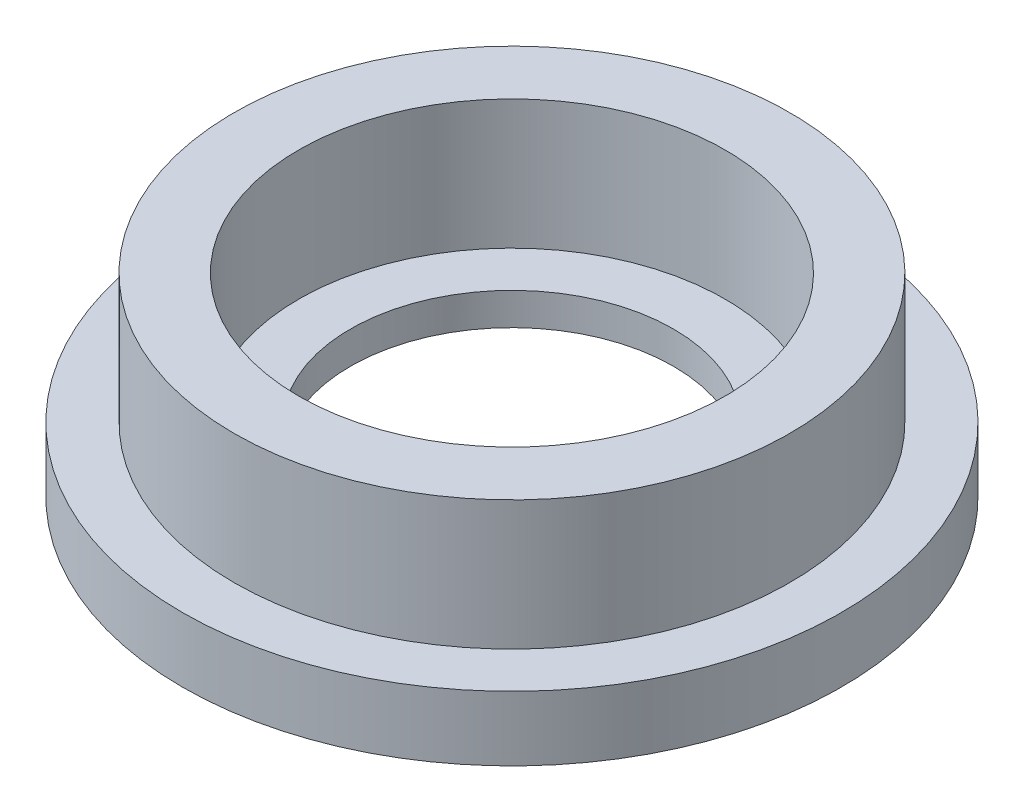
from build123d import *

# Parameters (mm, degrees)
SKETCH1_R           = 5.1
BOSS_EXTRUDE1_DEPTH = 1
SKETCH2_R           = 4.3
SKETCH2_R_2         = 3.3
BOSS_EXTRUDE2_DEPTH = 2
SKETCH3_R           = 2.5
CUT_EXTRUDE1_DEPTH  = 2
SKETCH4_R           = 3.3
CUT_EXTRUDE2_DEPTH  = 0.5


with BuildPart() as part:
    # Sketch1 → Boss-Extrude1 (new body)
    with BuildSketch(Plane(origin=(0, 0, 0), x_dir=(1, 0, 0), z_dir=(0, 1, 0))):
        with Locations(Location((0, 0, 0), (0, 0, 270))):
            Circle(SKETCH1_R)
    extrude(amount=BOSS_EXTRUDE1_DEPTH)

    # Sketch2 → Boss-Extrude2 (add)
    with BuildSketch(Plane(origin=(0, 1, 0), x_dir=(1, 0, 0), z_dir=(0, 1, 0))):
        with Locations(Location((0, 0, 0), (0, 0, 270))):
            Circle(SKETCH2_R)
        with Locations(Location((0, 0, 0), (0, 0, 270))):
            Circle(SKETCH2_R_2, mode=Mode.SUBTRACT)
    extrude(amount=BOSS_EXTRUDE2_DEPTH)

    # Sketch3 → Cut-Extrude1 (cut)
    with BuildSketch(Plane.XZ):
        with Locations(Location((0, 0, 0), (0, 0, 270))):
            Circle(SKETCH3_R)
    extrude(amount=-CUT_EXTRUDE1_DEPTH, mode=Mode.SUBTRACT)

    # Sketch4 → Cut-Extrude2 (cut)
    with BuildSketch(Plane.XZ):
        with Locations(Location((0, 0, 0), (0, 0, 90))):
            Circle(SKETCH4_R)
    extrude(amount=-CUT_EXTRUDE2_DEPTH, mode=Mode.SUBTRACT)


solid = part.part
